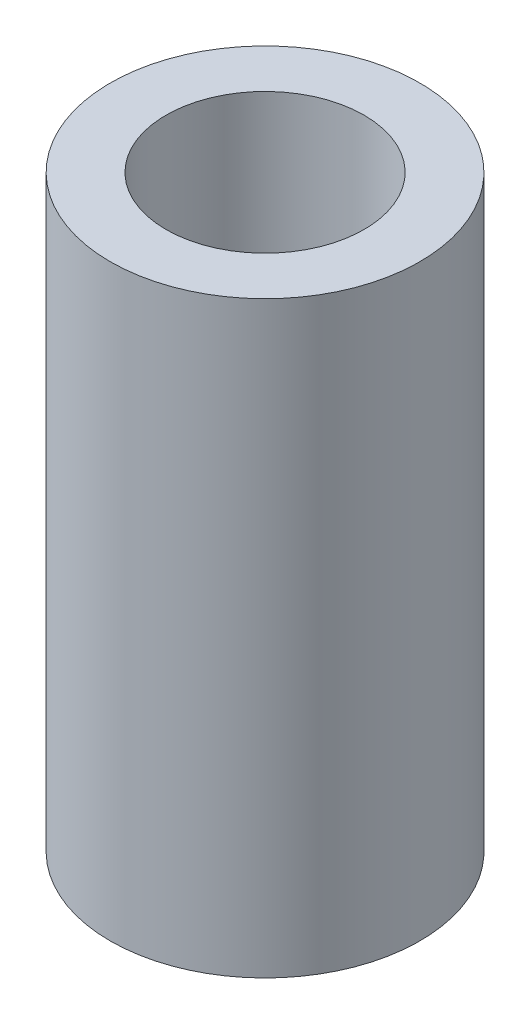
from build123d import *

# Parameters (mm, degrees)
CROQUIS1_R              = 2.5
CROQUIS1_R_2            = 1.6
SALIENTE_EXTRUIR1_DEPTH = 9.5


with BuildPart() as part:
    # Croquis1 → Saliente-Extruir1 (new body)
    with BuildSketch(Plane(origin=(0, 0, 0), x_dir=(1, 0, 0), z_dir=(0, 1, 0))):
        with Locations(Location((0, 0, 0), (0, 0, 270))):
            Circle(CROQUIS1_R)
        with Locations(Location((0, 0, 0), (0, 0, 270))):
            Circle(CROQUIS1_R_2, mode=Mode.SUBTRACT)
    extrude(amount=SALIENTE_EXTRUIR1_DEPTH)


solid = part.part
